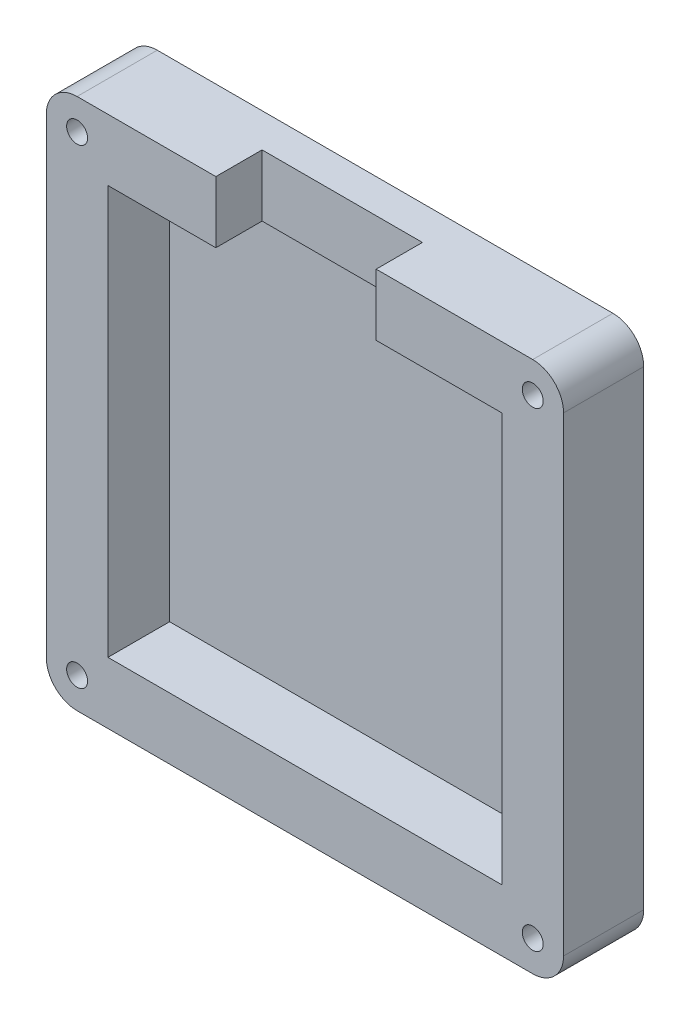
from build123d import *

# Parameters (mm, degrees)
BOSS_EXTRUDE4_START   = 3.1
SKETCH2_R             = 3.25
SKETCH2_R_2           = 1.7
BOSS_EXTRUDE4_DEPTH   = 9.9
BOSS_EXTRUDE4_2_DEPTH = 9.9
BOSS_EXTRUDE4_3_DEPTH = 9.9
BOSS_EXTRUDE4_4_DEPTH = 9.9
SKETCH2_12_W          = 83.893
SKETCH2_12_H          = 86.275
SKETCH2_12_R          = 3.25
SKETCH2_12_W_2        = 63.893
SKETCH2_12_H_2        = 66.275
BOSS_EXTRUDE5_DEPTH   = 13
SKETCH2_13_W          = 63.893
SKETCH2_13_H          = 66.275
BOSS_EXTRUDE6_DEPTH   = 3
SKETCH5_W             = 26
SKETCH5_H             = 10
CUT_EXTRUDE1_DEPTH    = 7.5
FILLET1_R             = 5
SKETCH7_W             = 0.189957265
SKETCH7_H             = 1.546794872
CUT_EXTRUDE2_DEPTH    = 0.2


with BuildPart() as part:
    # Sketch2 → Boss-Extrude4 (new body)
    with BuildSketch(Plane.XY.offset(BOSS_EXTRUDE4_START)):
        with Locations(Location((-36.9465, 38.1375, 0), (0, 0, 180))):
            Circle(SKETCH2_R)
        with Locations(Location((-36.9465, 38.1375, 0), (0, 0, 180))):
            Circle(SKETCH2_R_2, mode=Mode.SUBTRACT)
    extrude(amount=BOSS_EXTRUDE4_DEPTH)



with BuildPart() as body_2:
    # Sketch2 → Boss-Extrude4 2 (new body)
    with BuildSketch(Plane.XY.offset(BOSS_EXTRUDE4_START)):
        with Locations(Location((36.9465, 38.1375, 0), (0, 0, 180))):
            Circle(SKETCH2_R)
        with Locations(Location((36.9465, 38.1375, 0), (0, 0, 180))):
            Circle(SKETCH2_R_2, mode=Mode.SUBTRACT)
    extrude(amount=BOSS_EXTRUDE4_2_DEPTH)


with BuildPart() as body_3:
    # Sketch2 → Boss-Extrude4 3 (new body)
    with BuildSketch(Plane.XY.offset(BOSS_EXTRUDE4_START)):
        with Locations(Location((-36.9465, -38.1375, 0), (0, 0, 180))):
            Circle(SKETCH2_R)
        with Locations(Location((-36.9465, -38.1375, 0), (0, 0, 180))):
            Circle(SKETCH2_R_2, mode=Mode.SUBTRACT)
    extrude(amount=BOSS_EXTRUDE4_3_DEPTH)


with BuildPart() as body_4:
    # Sketch2 → Boss-Extrude4 4 (new body)
    with BuildSketch(Plane.XY.offset(BOSS_EXTRUDE4_START)):
        with Locations(Location((36.9465, -38.1375, 0), (0, 0, 180))):
            Circle(SKETCH2_R)
        with Locations(Location((36.9465, -38.1375, 0), (0, 0, 180))):
            Circle(SKETCH2_R_2, mode=Mode.SUBTRACT)
    extrude(amount=BOSS_EXTRUDE4_4_DEPTH)


with BuildPart() as part_1:
    add(part.part)

    add(body_2.part)  # Boss-Extrude5 merges body 2

    add(body_3.part)  # Boss-Extrude5 merges body 3

    add(body_4.part)  # Boss-Extrude5 merges body 4
    # Sketch2<12> → Boss-Extrude5 (add)
    with BuildSketch(Plane.XY):
        Rectangle(SKETCH2_12_W, SKETCH2_12_H)
        with Locations(Location((36.9465, -38.1375, 0), (0, 0, 180))):
            Circle(SKETCH2_12_R, mode=Mode.SUBTRACT)
        with Locations(Location((-36.9465, -38.1375, 0), (0, 0, 180))):
            Circle(SKETCH2_12_R, mode=Mode.SUBTRACT)
        with Locations(Location((36.9465, 38.1375, 0), (0, 0, 180))):
            Circle(SKETCH2_12_R, mode=Mode.SUBTRACT)
        with Locations(Location((-36.9465, 38.1375, 0), (0, 0, 180))):
            Circle(SKETCH2_12_R, mode=Mode.SUBTRACT)
        Rectangle(SKETCH2_12_W_2, SKETCH2_12_H_2, mode=Mode.SUBTRACT)
    extrude(amount=BOSS_EXTRUDE5_DEPTH)

    # Sketch2<13> → Boss-Extrude6 (add)
    with BuildSketch(Plane.XY):
        Rectangle(SKETCH2_13_W, SKETCH2_13_H)
    extrude(amount=BOSS_EXTRUDE6_DEPTH)

    # Sketch5 → Cut-Extrude1 (cut)
    with BuildSketch(Plane.XY.offset(13)):
        with Locations((-1.4465, 38.1375)):
            Rectangle(SKETCH5_W, SKETCH5_H)
    extrude(amount=-CUT_EXTRUDE1_DEPTH, mode=Mode.SUBTRACT)

    # Fillet1
    fillet1_edges = [part_1.edges().sort_by_distance(p)[0] for p in [
        (41.9465, -43.1375, 6.5),
        (41.9465, 43.1375, 6.5),
        (-41.9465, 43.1375, 6.5),
        (-41.9465, -43.1375, 6.5),
    ]]
    fillet(fillet1_edges, radius=FILLET1_R)

    # Sketch7 → Cut-Extrude2 (cut)
    # profile 1 of 15: a face of its own
    with BuildSketch(Plane(origin=(0, 0, 0), x_dir=(-1, 0, 0), z_dir=(0, 0, -1))):
        with BuildLine():
            Line((0.197612891, 2.170940171), (0.197612891, 0))
            Line((0.197612891, 0), (0.007655626, 0))
            Line((0.007655626, 0), (0.007655626, 0.267551416))
            add(Edge.make_bspline(
                [(0.007655626, 0.267551416), (-0.013764309, 0.243336994), (-0.055565582, 0.196082247), (-0.125379973, 0.134346838), (-0.199383585, 0.083318044), (-0.277217241, 0.042103571), (-0.358810655, 0.011144565), (-0.443982955, -0.010860398), (-0.532768886, -0.025008098), (-0.593397691, -0.026420835), (-0.624121885, -0.027136752)],
                knots=[0, 0, 0, 0, 1.074387032, 2.096679803, 3.090159297, 4.057316773, 5.018401886, 5.985159533, 6.978961417, 8, 8, 8, 8], degree=3))
            add(Edge.make_bspline(
                [(-0.624121885, -0.027136752), (-0.651437743, -0.026395089), (-0.705305824, -0.024932496), (-0.784547218, -0.01358577), (-0.860803007, 0.004636082), (-0.934145248, 0.029976144), (-1.004099355, 0.063589308), (-1.071264271, 0.10383092), (-1.135292042, 0.151752755), (-1.195206734, 0.206536944), (-1.250380373, 0.266042483), (-1.298798381, 0.329509552), (-1.3391681, 0.396663707), (-1.372925959, 0.46665471), (-1.39892851, 0.540021352), (-1.417055422, 0.616509925), (-1.42838893, 0.696029991), (-1.429850918, 0.750180084), (-1.430592237, 0.777637553)],
                knots=[0, 0, 0, 0, 1.033919861, 2.038935746, 3.024066025, 3.998881131, 4.97069526, 5.957263378, 6.95902576, 7.993208707, 9.027059324, 10.027763471, 11.009749337, 11.988697705, 12.965288445, 13.950418724, 14.960734635, 16, 16, 16, 16], degree=3))
            add(Edge.make_bspline(
                [(-1.430592237, 0.777637553), (-1.429834488, 0.804527507), (-1.428336458, 0.857687496), (-1.417176654, 0.935870328), (-1.398410282, 1.011174228), (-1.372074203, 1.083356761), (-1.338303116, 1.152505267), (-1.297222796, 1.218668654), (-1.248830278, 1.282029194), (-1.193039537, 1.341097031), (-1.132602795, 1.395659022), (-1.067948467, 1.443077825), (-1.000684864, 1.484030396), (-0.929768662, 1.516477974), (-0.856249508, 1.542730147), (-0.7794729, 1.560892942), (-0.699758279, 1.571595608), (-0.645637839, 1.57314547), (-0.61818572, 1.573931624)],
                knots=[0, 0, 0, 0, 1.020392517, 2.01726096, 2.990465484, 3.961182959, 4.928053699, 5.906110375, 6.912531644, 7.948652711, 8.985773172, 9.998621852, 10.987621588, 11.969261332, 12.953316658, 13.946091881, 14.958173133, 16, 16, 16, 16], degree=3))
            add(Edge.make_bspline(
                [(-0.61818572, 1.573931624), (-0.586606984, 1.572983904), (-0.524621435, 1.571123635), (-0.433968519, 1.555577403), (-0.348220774, 1.529474139), (-0.266884538, 1.493737983), (-0.190444714, 1.447291815), (-0.118340984, 1.391199273), (-0.05182726, 1.323872856), (-0.0124743, 1.273307761), (0.007655626, 1.247442575)],
                knots=[0, 0, 0, 0, 1.031072012, 2.023879775, 2.993683497, 3.952812103, 4.918022106, 5.908088563, 6.929940113, 8, 8, 8, 8], degree=3))
            Line((0.007655626, 1.247442575), (0.007655626, 2.170940171))
            Line((0.007655626, 2.170940171), (0.197612891, 2.170940171))
        make_face()
        with BuildLine():
            add(Edge.make_bspline(
                [(-0.61564165, 1.383974359), (-0.643408892, 1.382986397), (-0.698217012, 1.381036318), (-0.778676956, 1.365812347), (-0.855671259, 1.34048214), (-0.928814837, 1.305840228), (-0.996952283, 1.262279992), (-1.057847979, 1.209592298), (-1.111999993, 1.149214675), (-1.157543563, 1.08141959), (-1.194670197, 1.008740458), (-1.220775973, 0.932767584), (-1.237993089, 0.85487124), (-1.239752052, 0.802037616), (-1.240634972, 0.775517495)],
                knots=[0, 0, 0, 0, 1.031046209, 2.035121221, 3.029706178, 4.034933723, 5.034054252, 6.02443088, 7.017295772, 8.038157696, 9.050218397, 10.03989886, 11.016116709, 12, 12, 12, 12], degree=3))
            add(Edge.make_bspline(
                [(-1.240634972, 0.775517495), (-1.239507156, 0.749155858), (-1.237255944, 0.696535915), (-1.221078143, 0.618533375), (-1.193936505, 0.542542598), (-1.156899639, 0.469208568), (-1.110522489, 0.401121993), (-1.056766018, 0.339593443), (-0.995110372, 0.286683073), (-0.926816118, 0.242391778), (-0.853877012, 0.206612539), (-0.777172682, 0.181717129), (-0.698145034, 0.1656439), (-0.644410528, 0.16376643), (-0.617337697, 0.162820513)],
                knots=[0, 0, 0, 0, 0.979072187, 1.954306742, 2.945804271, 3.96968567, 4.997920485, 5.998718438, 6.996577872, 8.005894225, 9.015743152, 10.005417472, 10.995077863, 12, 12, 12, 12], degree=3))
            add(Edge.make_bspline(
                [(-0.617337697, 0.162820513), (-0.589853383, 0.163824396), (-0.535189809, 0.165821019), (-0.454491162, 0.181110166), (-0.376177542, 0.206370344), (-0.301315742, 0.24138553), (-0.231576939, 0.284781645), (-0.168985365, 0.335585933), (-0.116059041, 0.394673097), (-0.071190178, 0.459610285), (-0.036007902, 0.530798017), (-0.010380475, 0.60659536), (0.004771172, 0.687004956), (0.006680847, 0.741955997), (0.007655626, 0.770005342)],
                knots=[0, 0, 0, 0, 1.01762866, 2.023962475, 3.030623092, 4.058876274, 5.077231937, 6.066672613, 7.034107872, 8.005628644, 8.981990164, 9.965428785, 10.961468474, 12, 12, 12, 12], degree=3))
            add(Edge.make_bspline(
                [(0.007655626, 0.770005342), (0.007075262, 0.791376316), (0.005932923, 0.833441155), (-0.002794136, 0.895203987), (-0.016676401, 0.954309621), (-0.036238132, 1.0108202), (-0.061935242, 1.064423281), (-0.092927939, 1.115503745), (-0.129761234, 1.163795925), (-0.171842198, 1.20863483), (-0.217904011, 1.249532738), (-0.266644519, 1.286038731), (-0.31864119, 1.316028132), (-0.373019588, 1.34084833), (-0.429874062, 1.360599339), (-0.489667247, 1.373775706), (-0.551763586, 1.382823139), (-0.594124772, 1.383586579), (-0.61564165, 1.383974359)],
                knots=[0, 0, 0, 0, 1.050140795, 2.067009409, 3.05949893, 4.030605086, 5.00011959, 5.97591094, 6.962425594, 7.979863591, 8.993523472, 9.986985069, 10.967611495, 11.937549037, 12.921786183, 13.919465291, 14.943216303, 16, 16, 16, 16], degree=3))
        make_face(mode=Mode.SUBTRACT)
    # profile 2 of 15: a face of its own
    with BuildSketch(Plane(origin=(0, 0, 0), x_dir=(-1, 0, 0), z_dir=(0, 0, -1))):
        with BuildLine():
            Line((2.205732549, 1.546794872), (2.205732549, 0))
            Line((2.205732549, 0), (2.015775284, 0))
            Line((2.015775284, 0), (2.015775284, 0.267551416))
            add(Edge.make_bspline(
                [(2.015775284, 0.267551416), (1.994355349, 0.243336994), (1.952554076, 0.196082247), (1.882739685, 0.134346838), (1.808736073, 0.083318044), (1.730902417, 0.042103571), (1.649309003, 0.011144565), (1.564136703, -0.010860398), (1.475350772, -0.025008098), (1.414721967, -0.026420835), (1.383997773, -0.027136752)],
                knots=[0, 0, 0, 0, 1.074387032, 2.096679803, 3.090159297, 4.057316773, 5.018401886, 5.985159533, 6.978961417, 8, 8, 8, 8], degree=3))
            add(Edge.make_bspline(
                [(1.383997773, -0.027136752), (1.356681916, -0.026395089), (1.302813835, -0.024932496), (1.22357244, -0.01358577), (1.147316651, 0.004636082), (1.07397441, 0.029976144), (1.004020303, 0.063589308), (0.936855387, 0.10383092), (0.872827616, 0.151752755), (0.812912924, 0.206536944), (0.757739285, 0.266042483), (0.709321278, 0.329509552), (0.668951558, 0.396663707), (0.6351937, 0.46665471), (0.609191148, 0.540021352), (0.591064236, 0.616509925), (0.579730728, 0.696029991), (0.57826874, 0.750180084), (0.577527421, 0.777637553)],
                knots=[0, 0, 0, 0, 1.033919861, 2.038935746, 3.024066025, 3.998881131, 4.97069526, 5.957263378, 6.95902576, 7.993208707, 9.027059324, 10.027763471, 11.009749337, 11.988697705, 12.965288445, 13.950418724, 14.960734635, 16, 16, 16, 16], degree=3))
            add(Edge.make_bspline(
                [(0.577527421, 0.777637553), (0.57828517, 0.804527507), (0.5797832, 0.857687496), (0.590943004, 0.935870328), (0.609709376, 1.011174228), (0.636045455, 1.083356761), (0.669816542, 1.152505267), (0.710896862, 1.218668654), (0.75928938, 1.282029194), (0.815080121, 1.341097031), (0.875516863, 1.395659022), (0.940171191, 1.443077825), (1.007434795, 1.484030396), (1.078350996, 1.516477974), (1.15187015, 1.542730147), (1.228646758, 1.560892942), (1.308361379, 1.571595608), (1.362481819, 1.57314547), (1.389933938, 1.573931624)],
                knots=[0, 0, 0, 0, 1.020392517, 2.01726096, 2.990465484, 3.961182959, 4.928053699, 5.906110375, 6.912531644, 7.948652711, 8.985773172, 9.998621852, 10.987621588, 11.969261332, 12.953316658, 13.946091881, 14.958173133, 16, 16, 16, 16], degree=3))
            add(Edge.make_bspline(
                [(1.389933938, 1.573931624), (1.421502424, 1.573062127), (1.483406736, 1.571357083), (1.573956532, 1.55716772), (1.659617716, 1.533195885), (1.741051538, 1.500588636), (1.817965572, 1.457258214), (1.889631663, 1.402599857), (1.956799836, 1.336958282), (1.995734584, 1.286539013), (2.015775284, 1.260586939)],
                knots=[0, 0, 0, 0, 1.038897134, 2.037228247, 3.008116434, 3.962042015, 4.918381754, 5.904844433, 6.921570401, 8, 8, 8, 8], degree=3))
            Line((2.015775284, 1.260586939), (2.015775284, 1.546794872))
            Line((2.015775284, 1.546794872), (2.205732549, 1.546794872))
        make_face()
        with BuildLine():
            add(Edge.make_bspline(
                [(1.392478008, 1.383974359), (1.364710766, 1.382986397), (1.309902646, 1.381036318), (1.229442702, 1.365812347), (1.152448399, 1.34048214), (1.079304821, 1.305840228), (1.011167376, 1.262279992), (0.950271679, 1.209592298), (0.896119665, 1.149214675), (0.850576095, 1.08141959), (0.813449462, 1.008740458), (0.787343685, 0.932767584), (0.770126569, 0.85487124), (0.768367606, 0.802037616), (0.767484686, 0.775517495)],
                knots=[0, 0, 0, 0, 1.031046209, 2.035121221, 3.029706178, 4.034933723, 5.034054252, 6.02443088, 7.017295772, 8.038157696, 9.050218397, 10.03989886, 11.016116709, 12, 12, 12, 12], degree=3))
            add(Edge.make_bspline(
                [(0.767484686, 0.775517495), (0.768612502, 0.749155858), (0.770863714, 0.696535915), (0.787041515, 0.618533375), (0.814183153, 0.542542598), (0.85122002, 0.469208568), (0.897597169, 0.401121993), (0.95135364, 0.339593443), (1.013009286, 0.286683073), (1.08130354, 0.242391778), (1.154242646, 0.206612539), (1.230946976, 0.181717129), (1.309974624, 0.1656439), (1.363709131, 0.16376643), (1.390781961, 0.162820513)],
                knots=[0, 0, 0, 0, 0.979072187, 1.954306742, 2.945804271, 3.96968567, 4.997920485, 5.998718438, 6.996577872, 8.005894225, 9.015743152, 10.005417472, 10.995077863, 12, 12, 12, 12], degree=3))
            add(Edge.make_bspline(
                [(1.390781961, 0.162820513), (1.418266275, 0.163824396), (1.472929849, 0.165821019), (1.553628496, 0.181110166), (1.631942116, 0.206370344), (1.706803916, 0.24138553), (1.776542719, 0.284781645), (1.839134293, 0.335585933), (1.892060617, 0.394673097), (1.936929481, 0.459610285), (1.972111756, 0.530798017), (1.997739183, 0.60659536), (2.01289083, 0.687004956), (2.014800505, 0.741955997), (2.015775284, 0.770005342)],
                knots=[0, 0, 0, 0, 1.01762866, 2.023962475, 3.030623092, 4.058876274, 5.077231937, 6.066672613, 7.034107872, 8.005628644, 8.981990164, 9.965428785, 10.961468474, 12, 12, 12, 12], degree=3))
            add(Edge.make_bspline(
                [(2.015775284, 0.770005342), (2.01519492, 0.791376316), (2.014052581, 0.833441155), (2.005325522, 0.895203987), (1.991443257, 0.954309621), (1.971881526, 1.0108202), (1.946184416, 1.064423281), (1.915191719, 1.115503745), (1.878358424, 1.163795925), (1.83627746, 1.20863483), (1.790215647, 1.249532738), (1.741475139, 1.286038731), (1.689478468, 1.316028132), (1.63510007, 1.34084833), (1.578245596, 1.360599339), (1.518452412, 1.373775706), (1.456356072, 1.382823139), (1.413994886, 1.383586579), (1.392478008, 1.383974359)],
                knots=[0, 0, 0, 0, 1.050140795, 2.067009409, 3.05949893, 4.030605086, 5.00011959, 5.97591094, 6.962425594, 7.979863591, 8.993523472, 9.986985069, 10.967611495, 11.937549037, 12.921786183, 13.919465291, 14.943216303, 16, 16, 16, 16], degree=3))
        make_face(mode=Mode.SUBTRACT)
    # profile 3 of 15: a face of its own
    with BuildSketch(Plane(origin=(0, 0, 0), x_dir=(-1, 0, 0), z_dir=(0, 0, -1))):
        with BuildLine():
            Line((2.585647079, 1.546794872), (2.775604344, 1.546794872))
            Line((2.775604344, 1.546794872), (2.775604344, 1.319100561))
            add(Edge.make_bspline(
                [(2.775604344, 1.319100561), (2.789628022, 1.34030099), (2.816448197, 1.380846647), (2.861026968, 1.434470462), (2.906688507, 1.478869086), (2.953651406, 1.514249785), (3.002261019, 1.540746291), (3.051450508, 1.560154936), (3.101993769, 1.571631693), (3.135958361, 1.573163953), (3.152974803, 1.573931624)],
                knots=[0, 0, 0, 0, 1.2804753, 2.448899062, 3.506932113, 4.484331642, 5.4025378, 6.288909075, 7.142734305, 8, 8, 8, 8], degree=3))
            add(Edge.make_bspline(
                [(3.152974803, 1.573931624), (3.166174534, 1.573211639), (3.193333838, 1.571730223), (3.234447118, 1.561321772), (3.27680673, 1.54470411), (3.304107126, 1.529076928), (3.318339387, 1.520930155)],
                knots=[0, 0, 0, 0, 0.901110191, 1.854092781, 2.881294221, 4, 4, 4, 4], degree=3))
            Line((3.318339387, 1.520930155), (3.214032496, 1.356413595))
            add(Edge.make_bspline(
                [(3.214032496, 1.356413595), (3.204895135, 1.360489851), (3.187550676, 1.368227366), (3.162178153, 1.377384677), (3.138785154, 1.382776683), (3.123881668, 1.383593545), (3.116933804, 1.383974359)],
                knots=[0, 0, 0, 0, 1.180555205, 2.24091978, 3.179933427, 4, 4, 4, 4], degree=3))
            add(Edge.make_bspline(
                [(3.116933804, 1.383974359), (3.101690337, 1.382958336), (3.070598082, 1.380885945), (3.024947932, 1.36459438), (2.980650813, 1.338271973), (2.945470808, 1.309079443), (2.918230969, 1.280929109), (2.898793785, 1.256346503), (2.880963743, 1.228782283), (2.863927467, 1.198707665), (2.84840547, 1.165609139), (2.833918598, 1.129817386), (2.820820143, 1.091290951), (2.813351186, 1.064450094), (2.809525284, 1.050701122)],
                knots=[0, 0, 0, 0, 1.125678352, 2.296057538, 3.5422874, 4.923748041, 5.663163013, 6.437101912, 7.23742474, 8.08941207, 8.991984279, 9.93940061, 10.944477711, 12, 12, 12, 12], degree=3))
            add(Edge.make_bspline(
                [(2.809525284, 1.050701122), (2.806663313, 1.03843826), (2.800324264, 1.011276952), (2.79416081, 0.965709035), (2.788071149, 0.911870917), (2.783779385, 0.84961274), (2.779801236, 0.779089976), (2.777557519, 0.70019519), (2.775680858, 0.612847401), (2.775630622, 0.551781959), (2.775604344, 0.519838408)],
                knots=[0, 0, 0, 0, 0.566838948, 1.255505196, 2.06880316, 3.007127437, 4.065329342, 5.249902469, 6.561414163, 8, 8, 8, 8], degree=3))
            Line((2.775604344, 0.519838408), (2.775604344, 0))
            Line((2.775604344, 0), (2.585647079, 0))
            Line((2.585647079, 0), (2.585647079, 1.546794872))
        make_face()
    # profile 4 of 15: a face of its own
    with BuildSketch(Plane(origin=(0, 0, 0), x_dir=(-1, 0, 0), z_dir=(0, 0, -1))):
        with BuildLine():
            Line((4.240988959, 1.353869525), (4.112089387, 1.221153846))
            add(Edge.make_bspline(
                [(4.112089387, 1.221153846), (4.100967511, 1.234043225), (4.079525843, 1.25889243), (4.045519186, 1.292116275), (4.011638244, 1.320018138), (3.978346819, 1.343574981), (3.944807771, 1.361384703), (3.911414682, 1.374383976), (3.878132978, 1.382428402), (3.855886186, 1.383465229), (3.844961983, 1.383974359)],
                knots=[0, 0, 0, 0, 1.26578478, 2.440284043, 3.530471711, 4.527705817, 5.468200915, 6.346673037, 7.188140097, 8, 8, 8, 8], degree=3))
            add(Edge.make_bspline(
                [(3.844961983, 1.383974359), (3.831572923, 1.383324317), (3.805225149, 1.382045126), (3.767472392, 1.369276527), (3.732426062, 1.349676957), (3.702093031, 1.321876909), (3.676398101, 1.289967089), (3.657642208, 1.254288359), (3.646172303, 1.215917399), (3.644718013, 1.189289819), (3.643980412, 1.175784589)],
                knots=[0, 0, 0, 0, 0.99966794, 1.967205029, 2.953328237, 3.988086729, 5.028030931, 6.008226631, 6.989793394, 8, 8, 8, 8], degree=3))
            add(Edge.make_bspline(
                [(3.643980412, 1.175784589), (3.644652189, 1.163561114), (3.645993849, 1.139148624), (3.656423984, 1.103136241), (3.673034418, 1.068025556), (3.688558774, 1.046518465), (3.69655787, 1.035436699)],
                knots=[0, 0, 0, 0, 0.960159726, 1.917612774, 2.927026955, 4, 4, 4, 4], degree=3))
            add(Edge.make_bspline(
                [(3.69655787, 1.035436699), (3.701373887, 1.029519355), (3.711624174, 1.016925034), (3.730860752, 0.999445085), (3.752645789, 0.980127628), (3.778844037, 0.960813446), (3.808326802, 0.94047426), (3.841733417, 0.919911065), (3.878003712, 0.897556389), (3.90397056, 0.883378087), (3.917467992, 0.87600828)],
                knots=[0, 0, 0, 0, 0.66740084, 1.420478572, 2.27185888, 3.217733974, 4.268547843, 5.408967954, 6.65319498, 8, 8, 8, 8], degree=3))
            add(Edge.make_bspline(
                [(3.917467992, 0.87600828), (3.933925727, 0.866788743), (3.965716651, 0.848979635), (4.010887992, 0.821336147), (4.051883012, 0.793860953), (4.089049058, 0.766847887), (4.121671009, 0.739541153), (4.15073862, 0.712987414), (4.175526869, 0.686384356), (4.18940853, 0.66779814), (4.196043714, 0.658914263)],
                knots=[0, 0, 0, 0, 1.27191281, 2.456916733, 3.569705269, 4.599008579, 5.553216877, 6.436649441, 7.252746552, 8, 8, 8, 8], degree=3))
            add(Edge.make_bspline(
                [(4.196043714, 0.658914263), (4.207056747, 0.640973343), (4.228974727, 0.605267583), (4.251990917, 0.546473581), (4.26533213, 0.484116277), (4.267184045, 0.441461078), (4.268125711, 0.419771635)],
                knots=[0, 0, 0, 0, 0.995354457, 1.980940102, 2.973342416, 4, 4, 4, 4], degree=3))
            add(Edge.make_bspline(
                [(4.268125711, 0.419771635), (4.267690565, 0.404489818), (4.266833061, 0.374375328), (4.260871277, 0.330025216), (4.250617554, 0.287610508), (4.236651331, 0.246670979), (4.21779221, 0.207991048), (4.195689495, 0.170594841), (4.16915562, 0.135291302), (4.138862264, 0.102126788), (4.105693799, 0.071836836), (4.070311515, 0.045212825), (4.032671841, 0.02309406), (3.993043728, 0.004790732), (3.951337137, -0.009764834), (3.907545548, -0.019841698), (3.861808158, -0.025872844), (3.830705369, -0.026710122), (3.814857148, -0.027136752)],
                knots=[0, 0, 0, 0, 1.032770009, 2.035186124, 3.017557409, 3.978232242, 4.952395191, 5.920591857, 6.910227898, 7.931268572, 8.952309245, 9.941945286, 10.918353717, 11.897095711, 12.887975737, 13.898235213, 14.929059601, 16, 16, 16, 16], degree=3))
            add(Edge.make_bspline(
                [(3.814857148, -0.027136752), (3.793468428, -0.026536405), (3.750988182, -0.025344052), (3.688159637, -0.014152291), (3.62676375, 0.003262066), (3.567265133, 0.02728075), (3.510994388, 0.057609991), (3.459510447, 0.093933438), (3.412634468, 0.135051199), (3.385953417, 0.166567102), (3.372612891, 0.182325053)],
                knots=[0, 0, 0, 0, 1.013940152, 2.01379169, 3.017749504, 4.037548394, 5.051665909, 6.043208538, 7.021604269, 8, 8, 8, 8], degree=3))
            Line((3.372612891, 0.182325053), (3.498544381, 0.325641026))
            add(Edge.make_bspline(
                [(3.498544381, 0.325641026), (3.510501983, 0.312726478), (3.533683603, 0.287689673), (3.570756244, 0.254352572), (3.608480929, 0.226411803), (3.646480954, 0.203041738), (3.685318821, 0.185034709), (3.724776882, 0.17238394), (3.764774882, 0.164253405), (3.791639697, 0.16329892), (3.805104878, 0.162820513)],
                knots=[0, 0, 0, 0, 1.179806542, 2.287233372, 3.337373186, 4.324005949, 5.273901747, 6.200048787, 7.097828587, 8, 8, 8, 8], degree=3))
            add(Edge.make_bspline(
                [(3.805104878, 0.162820513), (3.823440005, 0.163649535), (3.859263767, 0.165269307), (3.91057404, 0.179975358), (3.957950257, 0.2030349), (3.999088185, 0.235743265), (4.034105206, 0.273816397), (4.059461768, 0.316702555), (4.075352598, 0.363143102), (4.077218893, 0.395335971), (4.078168446, 0.411715411)],
                knots=[0, 0, 0, 0, 1.072336372, 2.095165389, 3.102688358, 4.141489647, 5.156069229, 6.117746104, 7.042326257, 8, 8, 8, 8], degree=3))
            add(Edge.make_bspline(
                [(4.078168446, 0.411715411), (4.077511497, 0.425207419), (4.076214438, 0.451845582), (4.066028269, 0.490399359), (4.04993383, 0.526968877), (4.034086257, 0.548371187), (4.026015001, 0.559271501)],
                knots=[0, 0, 0, 0, 1.013901739, 2.00181326, 2.98231254, 4, 4, 4, 4], degree=3))
            add(Edge.make_bspline(
                [(4.026015001, 0.559271501), (4.021163362, 0.564735744), (4.010594741, 0.576638838), (3.991208953, 0.593829243), (3.967997065, 0.612357998), (3.940698014, 0.631910912), (3.909256768, 0.652230068), (3.873545894, 0.673208867), (3.834054608, 0.69584373), (3.806132369, 0.710853712), (3.791536502, 0.71869992)],
                knots=[0, 0, 0, 0, 0.615000592, 1.339693406, 2.178160186, 3.116406724, 4.166410947, 5.330106347, 6.604359322, 8, 8, 8, 8], degree=3))
            add(Edge.make_bspline(
                [(3.791536502, 0.71869992), (3.775784486, 0.727492633), (3.745236301, 0.744544509), (3.701967225, 0.771103282), (3.662931444, 0.798116348), (3.627189668, 0.824068398), (3.595644679, 0.850327731), (3.568420748, 0.876923497), (3.544446042, 0.902783108), (3.531173083, 0.921105759), (3.52483311, 0.929857772)],
                knots=[0, 0, 0, 0, 1.262093308, 2.447601706, 3.550203992, 4.582594899, 5.537233252, 6.418365656, 7.244515135, 8, 8, 8, 8], degree=3))
            add(Edge.make_bspline(
                [(3.52483311, 0.929857772), (3.513868414, 0.94748393), (3.49193519, 0.982742405), (3.470638384, 1.041592074), (3.4559995, 1.103546942), (3.454691769, 1.146295659), (3.454023147, 1.168152377)],
                knots=[0, 0, 0, 0, 0.985009483, 1.970363186, 2.962279964, 4, 4, 4, 4], degree=3))
            add(Edge.make_bspline(
                [(3.454023147, 1.168152377), (3.454346208, 1.182440118), (3.454978484, 1.210403251), (3.460024649, 1.251490061), (3.469212017, 1.290526325), (3.480735708, 1.328098285), (3.496751621, 1.363478123), (3.515889858, 1.397137641), (3.538379396, 1.429030316), (3.564289387, 1.458665543), (3.592777691, 1.485583088), (3.623556909, 1.50904702), (3.655934807, 1.529068482), (3.69004847, 1.545859794), (3.726225613, 1.55856063), (3.764213361, 1.567303906), (3.803934822, 1.573143005), (3.831089312, 1.573664965), (3.844961983, 1.573931624)],
                knots=[0, 0, 0, 0, 1.087655834, 2.128696564, 3.144119009, 4.137814668, 5.115653402, 6.093965665, 7.082169637, 8.081268856, 9.086088321, 10.061021666, 11.022561449, 11.980240094, 12.950172527, 13.934149372, 14.944599409, 16, 16, 16, 16], degree=3))
            add(Edge.make_bspline(
                [(3.844961983, 1.573931624), (3.861406707, 1.573263761), (3.894604641, 1.571915506), (3.944409582, 1.561207779), (3.994141174, 1.543589187), (4.0439272, 1.519255846), (4.093402947, 1.487767783), (4.143003617, 1.44971054), (4.193324664, 1.405334494), (4.224745863, 1.371407819), (4.240988959, 1.353869525)],
                knots=[0, 0, 0, 0, 0.845714091, 1.707292901, 2.609013841, 3.555613372, 4.552488639, 5.621697636, 6.770543573, 8, 8, 8, 8], degree=3))
        make_face()
    # profile 5 of 15: a face of its own
    with BuildSketch(Plane(origin=(0, 0, 0), x_dir=(-1, 0, 0), z_dir=(0, 0, -1))):
        with BuildLine():
            Line((4.648040241, 2.170940171), (4.837997506, 2.170940171))
            Line((4.837997506, 2.170940171), (4.837997506, 1.254650775))
            add(Edge.make_bspline(
                [(4.837997506, 1.254650775), (4.858388446, 1.280137849), (4.89809065, 1.32976249), (4.964914492, 1.39450902), (5.033537353, 1.450630091), (5.106329404, 1.495304129), (5.181955195, 1.530595944), (5.260733685, 1.555625615), (5.342679511, 1.571017469), (5.398332816, 1.57295175), (5.426525818, 1.573931624)],
                knots=[0, 0, 0, 0, 1.125788106, 2.19196713, 3.20547328, 4.180437432, 5.132270164, 6.079753143, 7.027236121, 8, 8, 8, 8], degree=3))
            add(Edge.make_bspline(
                [(5.426525818, 1.573931624), (5.455149437, 1.572876054), (5.511172763, 1.57081005), (5.592743933, 1.554473386), (5.668920272, 1.526559126), (5.739475329, 1.488358115), (5.802869312, 1.440779786), (5.859021313, 1.385848342), (5.904886939, 1.322182687), (5.936092119, 1.263365809), (5.956396037, 1.211030467), (5.969248332, 1.166135053), (5.980145657, 1.116107991), (5.989640259, 1.060975034), (5.995968234, 1.000471526), (6.001051027, 0.934870429), (6.004665359, 0.864175505), (6.004805424, 0.815238021), (6.004877848, 0.789933894)],
                knots=[0, 0, 0, 0, 1.235656852, 2.418478516, 3.575258207, 4.727955599, 5.870717718, 6.98870536, 8.107142894, 9.245821548, 9.854588956, 10.528768408, 11.260415777, 12.065282286, 12.943670737, 13.886611085, 14.907229059, 16, 16, 16, 16], degree=3))
            Line((6.004877848, 0.789933894), (6.004877848, 0))
            Line((6.004877848, 0), (5.814920583, 0))
            Line((5.814920583, 0), (5.814920583, 0.727604167))
            add(Edge.make_bspline(
                [(5.814920583, 0.727604167), (5.814805495, 0.748663591), (5.814585351, 0.788946685), (5.813857614, 0.846620474), (5.812233093, 0.898930041), (5.809607927, 0.94570774), (5.806847003, 0.987018786), (5.803047093, 1.022803186), (5.798626141, 1.053110088), (5.794653593, 1.071352506), (5.792871972, 1.079533921)],
                knots=[0, 0, 0, 0, 1.430932559, 2.737130458, 3.918967929, 4.986496826, 5.920444988, 6.731744033, 7.431208747, 8, 8, 8, 8], degree=3))
            add(Edge.make_bspline(
                [(5.792871972, 1.079533921), (5.785963024, 1.103539499), (5.772680611, 1.149690084), (5.741808739, 1.212381161), (5.703249718, 1.265832885), (5.65617066, 1.309323907), (5.601404411, 1.343439457), (5.538593862, 1.367066163), (5.468330163, 1.381730262), (5.418829511, 1.38320546), (5.39302889, 1.383974359)],
                knots=[0, 0, 0, 0, 1.090059168, 2.095632401, 3.037101401, 3.955032261, 4.878929692, 5.839099886, 6.873700383, 8, 8, 8, 8], degree=3))
            add(Edge.make_bspline(
                [(5.39302889, 1.383974359), (5.377747903, 1.383686597), (5.347507225, 1.383117125), (5.302664937, 1.377399767), (5.25916498, 1.36805697), (5.216588424, 1.355414702), (5.175837633, 1.338211925), (5.135724789, 1.318297001), (5.097386387, 1.293920104), (5.060141631, 1.266569283), (5.02547817, 1.236288999), (4.993227962, 1.204329174), (4.964478585, 1.17029622), (4.938432342, 1.134736149), (4.915948331, 1.097161208), (4.896321943, 1.057933739), (4.879669403, 1.017002156), (4.871394632, 0.988593428), (4.867254317, 0.974379006)],
                knots=[0, 0, 0, 0, 1.024319606, 2.027102035, 3.025350316, 4.005802111, 5.00026367, 5.987881639, 7.005602596, 8.042517216, 9.083927026, 10.089214625, 11.084353441, 12.06828073, 13.041928858, 14.016821737, 15.00770877, 16, 16, 16, 16], degree=3))
            add(Edge.make_bspline(
                [(4.867254317, 0.974379006), (4.864871902, 0.964085384), (4.859680325, 0.941654313), (4.854047069, 0.904658412), (4.849004687, 0.861668082), (4.844741993, 0.812748529), (4.842127555, 0.757720492), (4.839310428, 0.696959483), (4.838261762, 0.630084899), (4.838088224, 0.583581426), (4.837997506, 0.559271501)],
                knots=[0, 0, 0, 0, 0.607992626, 1.324890765, 2.152360218, 3.099583803, 4.150613268, 5.323148443, 6.60066238, 8, 8, 8, 8], degree=3))
            Line((4.837997506, 0.559271501), (4.837997506, 0))
            Line((4.837997506, 0), (4.648040241, 0))
            Line((4.648040241, 0), (4.648040241, 2.170940171))
        make_face()
    # profile 6 of 15: a face of its own
    with BuildSketch(Plane(origin=(0, 0, 0), x_dir=(-1, 0, 0), z_dir=(0, 0, -1))):
        Polygon((6.54506882, 1.51965812), (6.413201165, 1.51965812), (6.384792378, 2.170940171), (6.574749643, 2.170940171), align=None)
    # profile 7 of 15: a face of its own
    with BuildSketch(Plane(origin=(0, 0, 0), x_dir=(-1, 0, 0), z_dir=(0, 0, -1))):
        with BuildLine():
            Line((7.741629985, 1.353869525), (7.612730412, 1.221153846))
            add(Edge.make_bspline(
                [(7.612730412, 1.221153846), (7.601608536, 1.234043225), (7.580166869, 1.25889243), (7.546160211, 1.292116275), (7.51227927, 1.320018138), (7.478987845, 1.343574981), (7.445448796, 1.361384703), (7.412055708, 1.374383976), (7.378774004, 1.382428402), (7.356527211, 1.383465229), (7.345603008, 1.383974359)],
                knots=[0, 0, 0, 0, 1.26578478, 2.440284043, 3.530471711, 4.527705817, 5.468200915, 6.346673037, 7.188140097, 8, 8, 8, 8], degree=3))
            add(Edge.make_bspline(
                [(7.345603008, 1.383974359), (7.332213949, 1.383324317), (7.305866175, 1.382045126), (7.268113418, 1.369276527), (7.233067087, 1.349676957), (7.202734057, 1.321876909), (7.177039126, 1.289967089), (7.158283233, 1.254288359), (7.146813329, 1.215917399), (7.145359039, 1.189289819), (7.144621438, 1.175784589)],
                knots=[0, 0, 0, 0, 0.99966794, 1.967205029, 2.953328237, 3.988086729, 5.028030931, 6.008226631, 6.989793394, 8, 8, 8, 8], degree=3))
            add(Edge.make_bspline(
                [(7.144621438, 1.175784589), (7.145293215, 1.163561114), (7.146634875, 1.139148624), (7.15706501, 1.103136241), (7.173675444, 1.068025556), (7.189199799, 1.046518465), (7.197198895, 1.035436699)],
                knots=[0, 0, 0, 0, 0.960159726, 1.917612774, 2.927026955, 4, 4, 4, 4], degree=3))
            add(Edge.make_bspline(
                [(7.197198895, 1.035436699), (7.202014913, 1.029519355), (7.212265199, 1.016925034), (7.231501778, 0.999445085), (7.253286815, 0.980127628), (7.279485063, 0.960813446), (7.308967828, 0.94047426), (7.342374442, 0.919911065), (7.378644738, 0.897556389), (7.404611585, 0.883378087), (7.418109018, 0.87600828)],
                knots=[0, 0, 0, 0, 0.66740084, 1.420478572, 2.27185888, 3.217733974, 4.268547843, 5.408967954, 6.65319498, 8, 8, 8, 8], degree=3))
            add(Edge.make_bspline(
                [(7.418109018, 0.87600828), (7.434566753, 0.866788743), (7.466357677, 0.848979635), (7.511529017, 0.821336147), (7.552524037, 0.793860953), (7.589690084, 0.766847887), (7.622312035, 0.739541153), (7.651379645, 0.712987414), (7.676167895, 0.686384356), (7.690049555, 0.66779814), (7.696684739, 0.658914263)],
                knots=[0, 0, 0, 0, 1.27191281, 2.456916733, 3.569705269, 4.599008579, 5.553216877, 6.436649441, 7.252746552, 8, 8, 8, 8], degree=3))
            add(Edge.make_bspline(
                [(7.696684739, 0.658914263), (7.707697772, 0.640973343), (7.729615753, 0.605267583), (7.752631942, 0.546473581), (7.765973156, 0.484116277), (7.76782507, 0.441461078), (7.768766737, 0.419771635)],
                knots=[0, 0, 0, 0, 0.995354457, 1.980940102, 2.973342416, 4, 4, 4, 4], degree=3))
            add(Edge.make_bspline(
                [(7.768766737, 0.419771635), (7.76833159, 0.404489818), (7.767474086, 0.374375328), (7.761512303, 0.330025216), (7.751258579, 0.287610508), (7.737292357, 0.246670979), (7.718433236, 0.207991048), (7.696330521, 0.170594841), (7.669796645, 0.135291302), (7.63950329, 0.102126788), (7.606334824, 0.071836836), (7.570952541, 0.045212825), (7.533312867, 0.02309406), (7.493684754, 0.004790732), (7.451978163, -0.009764834), (7.408186573, -0.019841698), (7.362449184, -0.025872844), (7.331346395, -0.026710122), (7.315498174, -0.027136752)],
                knots=[0, 0, 0, 0, 1.032770009, 2.035186124, 3.017557409, 3.978232242, 4.952395191, 5.920591857, 6.910227898, 7.931268572, 8.952309245, 9.941945286, 10.918353717, 11.897095711, 12.887975737, 13.898235213, 14.929059601, 16, 16, 16, 16], degree=3))
            add(Edge.make_bspline(
                [(7.315498174, -0.027136752), (7.294109454, -0.026536405), (7.251629207, -0.025344052), (7.188800663, -0.014152291), (7.127404776, 0.003262066), (7.067906158, 0.02728075), (7.011635413, 0.057609991), (6.960151473, 0.093933438), (6.913275493, 0.135051199), (6.886594442, 0.166567102), (6.873253917, 0.182325053)],
                knots=[0, 0, 0, 0, 1.013940152, 2.01379169, 3.017749504, 4.037548394, 5.051665909, 6.043208538, 7.021604269, 8, 8, 8, 8], degree=3))
            Line((6.873253917, 0.182325053), (6.999185407, 0.325641026))
            add(Edge.make_bspline(
                [(6.999185407, 0.325641026), (7.011143009, 0.312726478), (7.034324629, 0.287689673), (7.071397269, 0.254352572), (7.109121955, 0.226411803), (7.14712198, 0.203041738), (7.185959846, 0.185034709), (7.225417908, 0.17238394), (7.265415907, 0.164253405), (7.292280723, 0.16329892), (7.305745904, 0.162820513)],
                knots=[0, 0, 0, 0, 1.179806542, 2.287233372, 3.337373186, 4.324005949, 5.273901747, 6.200048787, 7.097828587, 8, 8, 8, 8], degree=3))
            add(Edge.make_bspline(
                [(7.305745904, 0.162820513), (7.32408103, 0.163649535), (7.359904792, 0.165269307), (7.411215065, 0.179975358), (7.458591282, 0.2030349), (7.49972921, 0.235743265), (7.534746231, 0.273816397), (7.560102794, 0.316702555), (7.575993624, 0.363143102), (7.577859918, 0.395335971), (7.578809472, 0.411715411)],
                knots=[0, 0, 0, 0, 1.072336372, 2.095165389, 3.102688358, 4.141489647, 5.156069229, 6.117746104, 7.042326257, 8, 8, 8, 8], degree=3))
            add(Edge.make_bspline(
                [(7.578809472, 0.411715411), (7.578152523, 0.425207419), (7.576855464, 0.451845582), (7.566669295, 0.490399359), (7.550574855, 0.526968877), (7.534727282, 0.548371187), (7.526656027, 0.559271501)],
                knots=[0, 0, 0, 0, 1.013901739, 2.00181326, 2.98231254, 4, 4, 4, 4], degree=3))
            add(Edge.make_bspline(
                [(7.526656027, 0.559271501), (7.521804388, 0.564735744), (7.511235767, 0.576638838), (7.491849978, 0.593829243), (7.46863809, 0.612357998), (7.441339039, 0.631910912), (7.409897793, 0.652230068), (7.37418692, 0.673208867), (7.334695634, 0.69584373), (7.306773395, 0.710853712), (7.292177528, 0.71869992)],
                knots=[0, 0, 0, 0, 0.615000592, 1.339693406, 2.178160186, 3.116406724, 4.166410947, 5.330106347, 6.604359322, 8, 8, 8, 8], degree=3))
            add(Edge.make_bspline(
                [(7.292177528, 0.71869992), (7.276425512, 0.727492633), (7.245877327, 0.744544509), (7.202608251, 0.771103282), (7.16357247, 0.798116348), (7.127830694, 0.824068398), (7.096285705, 0.850327731), (7.069061774, 0.876923497), (7.045087067, 0.902783108), (7.031814109, 0.921105759), (7.025474136, 0.929857772)],
                knots=[0, 0, 0, 0, 1.262093308, 2.447601706, 3.550203992, 4.582594899, 5.537233252, 6.418365656, 7.244515135, 8, 8, 8, 8], degree=3))
            add(Edge.make_bspline(
                [(7.025474136, 0.929857772), (7.01450944, 0.94748393), (6.992576216, 0.982742405), (6.97127941, 1.041592074), (6.956640526, 1.103546942), (6.955332794, 1.146295659), (6.954664173, 1.168152377)],
                knots=[0, 0, 0, 0, 0.985009483, 1.970363186, 2.962279964, 4, 4, 4, 4], degree=3))
            add(Edge.make_bspline(
                [(6.954664173, 1.168152377), (6.954987234, 1.182440118), (6.95561951, 1.210403251), (6.960665675, 1.251490061), (6.969853043, 1.290526325), (6.981376734, 1.328098285), (6.997392646, 1.363478123), (7.016530884, 1.397137641), (7.039020422, 1.429030316), (7.064930412, 1.458665543), (7.093418717, 1.485583088), (7.124197935, 1.50904702), (7.156575833, 1.529068482), (7.190689496, 1.545859794), (7.226866639, 1.55856063), (7.264854387, 1.567303906), (7.304575847, 1.573143005), (7.331730338, 1.573664965), (7.345603008, 1.573931624)],
                knots=[0, 0, 0, 0, 1.087655834, 2.128696564, 3.144119009, 4.137814668, 5.115653402, 6.093965665, 7.082169637, 8.081268856, 9.086088321, 10.061021666, 11.022561449, 11.980240094, 12.950172527, 13.934149372, 14.944599409, 16, 16, 16, 16], degree=3))
            add(Edge.make_bspline(
                [(7.345603008, 1.573931624), (7.362047733, 1.573263761), (7.395245667, 1.571915506), (7.445050607, 1.561207779), (7.4947822, 1.543589187), (7.544568226, 1.519255846), (7.594043972, 1.487767783), (7.643644643, 1.44971054), (7.69396569, 1.405334494), (7.725386888, 1.371407819), (7.741629985, 1.353869525)],
                knots=[0, 0, 0, 0, 0.845714091, 1.707292901, 2.609013841, 3.555613372, 4.552488639, 5.621697636, 6.770543573, 8, 8, 8, 8], degree=3))
        make_face()
    # profile 8 of 15: a face of its own
    with BuildSketch(Plane(origin=(0, 0, 0), x_dir=(-1, 0, 0), z_dir=(0, 0, -1))):
        Polygon((9.152741096, 2.170940171), (9.342698361, 2.170940171), (9.342698361, 1.546794872), (9.614065882, 1.546794872), (9.614065882, 1.356837607), (9.342698361, 1.356837607), (9.342698361, 0), (9.152741096, 0), (9.152741096, 1.356837607), (8.881373575, 1.356837607), (8.881373575, 1.546794872), (9.152741096, 1.546794872), align=None)
    # profile 9 of 15: a face of its own
    with BuildSketch(Plane(origin=(0, 0, 0), x_dir=(-1, 0, 0), z_dir=(0, 0, -1))):
        with BuildLine():
            Line((11.209198094, 0.488461538), (11.377954771, 0.399843082))
            add(Edge.make_bspline(
                [(11.377954771, 0.399843082), (11.364506926, 0.375989258), (11.338342743, 0.329579163), (11.293348005, 0.26581799), (11.246181371, 0.208457705), (11.194713733, 0.159030723), (11.140484927, 0.1159406), (11.083194227, 0.078241058), (11.02254337, 0.046117001), (10.958529489, 0.019052377), (10.890614998, -0.001757175), (10.818635319, -0.016455441), (10.742452558, -0.025540942), (10.690233678, -0.026596337), (10.663494969, -0.027136752)],
                knots=[0, 0, 0, 0, 1.120438281, 2.179929193, 3.190490725, 4.156257408, 5.095198341, 6.022838206, 6.959905092, 7.901321166, 8.864066838, 9.862729781, 10.905609505, 12, 12, 12, 12], degree=3))
            add(Edge.make_bspline(
                [(10.663494969, -0.027136752), (10.633775773, -0.026442984), (10.575802231, -0.025089644), (10.491413908, -0.013422296), (10.411960641, 0.005610987), (10.337446896, 0.032199672), (10.268055153, 0.06692953), (10.203647493, 0.109238359), (10.143885209, 0.158908818), (10.09065152, 0.216371143), (10.042727839, 0.277864517), (10.000439367, 0.3419426), (9.965086539, 0.408444169), (9.936328532, 0.476945867), (9.913102733, 0.547015936), (9.89691525, 0.619291919), (9.887583926, 0.693578201), (9.886154, 0.743832304), (9.885433404, 0.769157318)],
                knots=[0, 0, 0, 0, 1.145258523, 2.234067595, 3.276747158, 4.290159414, 5.277019952, 6.260822364, 7.254936242, 8.264827045, 9.274100331, 10.257902744, 11.220704747, 12.172965371, 13.118907548, 14.062713208, 15.023725156, 16, 16, 16, 16], degree=3))
            add(Edge.make_bspline(
                [(9.885433404, 0.769157318), (9.886073932, 0.792921335), (9.887343375, 0.840018477), (9.895344851, 0.909726688), (9.909525485, 0.977477228), (9.9289845, 1.043326394), (9.954113111, 1.107163932), (9.984854501, 1.169028695), (10.021256558, 1.228854851), (10.04936146, 1.266593889), (10.06351834, 1.285603632)],
                knots=[0, 0, 0, 0, 1.024358464, 2.0301432, 3.019427413, 4.004406732, 4.986367066, 5.972626655, 6.978780325, 8, 8, 8, 8], degree=3))
            add(Edge.make_bspline(
                [(10.06351834, 1.285603632), (10.082693938, 1.308505282), (10.120437701, 1.353583116), (10.184274164, 1.412812485), (10.253398568, 1.462429435), (10.326944647, 1.50355756), (10.405767181, 1.534807813), (10.48880661, 1.558095732), (10.577008464, 1.571145291), (10.637306383, 1.572988504), (10.668159098, 1.573931624)],
                knots=[0, 0, 0, 0, 1.030682036, 2.02871468, 2.997146059, 3.962720338, 4.930598197, 5.918074684, 6.934738563, 8, 8, 8, 8], degree=3))
            add(Edge.make_bspline(
                [(10.668159098, 1.573931624), (10.699877412, 1.573112747), (10.762101513, 1.571506296), (10.852835224, 1.556613228), (10.938687658, 1.532995731), (11.019624458, 1.499640819), (11.095653831, 1.456606233), (11.166281585, 1.403301405), (11.232715595, 1.341362848), (11.271365068, 1.293729859), (11.291032362, 1.269491186)],
                knots=[0, 0, 0, 0, 1.056321875, 2.072262726, 3.055038591, 4.01806755, 4.982017516, 5.957941055, 6.960871419, 8, 8, 8, 8], degree=3))
            add(Edge.make_bspline(
                [(11.291032362, 1.269491186), (11.304413891, 1.25122521), (11.331087879, 1.214814843), (11.36449922, 1.155444668), (11.393502026, 1.093329213), (11.41668434, 1.027464414), (11.435455848, 0.958630668), (11.449036877, 0.886335891), (11.45700136, 0.810601611), (11.458566906, 0.758999361), (11.459365028, 0.732692308)],
                knots=[0, 0, 0, 0, 0.94817472, 1.890038105, 2.849395472, 3.817997239, 4.812318967, 5.836947057, 6.897266129, 8, 8, 8, 8], degree=3))
            Line((11.459365028, 0.732692308), (10.075390669, 0.732692308))
            add(Edge.make_bspline(
                [(10.075390669, 0.732692308), (10.076321764, 0.712311551), (10.078152725, 0.672233614), (10.086689026, 0.613589379), (10.100144237, 0.5577255), (10.119054575, 0.505060994), (10.141955, 0.454908012), (10.170007315, 0.40763859), (10.203474569, 0.363468032), (10.24080392, 0.322001239), (10.282355354, 0.285074017), (10.326069206, 0.252022705), (10.372571505, 0.224321225), (10.421495584, 0.201836244), (10.47276233, 0.184233853), (10.526387896, 0.172218552), (10.582266757, 0.16417092), (10.620358129, 0.163276075), (10.639750311, 0.162820513)],
                knots=[0, 0, 0, 0, 1.094153842, 2.151609401, 3.174256925, 4.172055639, 5.149267565, 6.128595816, 7.11444997, 8.118368179, 9.117203808, 10.09244225, 11.054858984, 12.015122123, 12.976791628, 13.957293641, 14.960065497, 16, 16, 16, 16], degree=3))
            add(Edge.make_bspline(
                [(10.639750311, 0.162820513), (10.658710291, 0.163188242), (10.696330527, 0.163917888), (10.752356189, 0.171012901), (10.807473903, 0.182485401), (10.861455545, 0.198142681), (10.913205533, 0.217239158), (10.961130223, 0.240282315), (11.005205401, 0.265772876), (11.046399947, 0.294928251), (11.086357167, 0.330614154), (11.125994766, 0.375146233), (11.168495409, 0.427813452), (11.195098639, 0.467452974), (11.209198094, 0.488461538)],
                knots=[0, 0, 0, 0, 0.99110716, 1.966546729, 2.947904876, 3.932708344, 4.903319531, 5.828989031, 6.710028674, 7.56322171, 8.463672341, 9.504779593, 10.677557249, 12, 12, 12, 12], degree=3))
        make_face()
        with BuildLine():
            add(Edge.make_bspline(
                [(11.269407763, 0.922649573), (11.262455042, 0.947845692), (11.249073293, 0.99634011), (11.221111301, 1.06349341), (11.189620417, 1.123176093), (11.152353942, 1.174931395), (11.110130236, 1.220895424), (11.061359102, 1.261062854), (11.006666919, 1.296996265), (10.946336391, 1.327326586), (10.882448263, 1.353143787), (10.815557852, 1.370455166), (10.747305761, 1.38231427), (10.701141693, 1.383418631), (10.677911368, 1.383974359)],
                knots=[0, 0, 0, 0, 1.154881502, 2.222775134, 3.210006277, 4.132804581, 5.035138423, 5.962687519, 6.919655026, 7.923214229, 8.944639381, 9.960483929, 10.97369054, 12, 12, 12, 12], degree=3))
            add(Edge.make_bspline(
                [(10.677911368, 1.383974359), (10.658952422, 1.383604443), (10.621474572, 1.382873198), (10.566259164, 1.375936501), (10.513233822, 1.364470309), (10.462007291, 1.348767692), (10.413250861, 1.327837728), (10.365961644, 1.303294538), (10.321342071, 1.273333676), (10.293437573, 1.250498559), (10.279340321, 1.23896234)],
                knots=[0, 0, 0, 0, 1.04873581, 2.073130211, 3.073294108, 4.04793562, 5.032784715, 6.005352987, 6.992311501, 8, 8, 8, 8], degree=3))
            add(Edge.make_bspline(
                [(10.279340321, 1.23896234), (10.26924486, 1.229833873), (10.248814108, 1.21136008), (10.22151484, 1.179531941), (10.195376745, 1.145210758), (10.17158925, 1.107083468), (10.1497709, 1.065584235), (10.129354152, 1.021063094), (10.110977607, 0.973182201), (10.100638531, 0.939816012), (10.095319221, 0.922649573)],
                knots=[0, 0, 0, 0, 0.879870761, 1.780643979, 2.707998968, 3.669668524, 4.684282772, 5.740141944, 6.837334558, 8, 8, 8, 8], degree=3))
            Line((10.095319221, 0.922649573), (11.269407763, 0.922649573))
        make_face(mode=Mode.SUBTRACT)
    # profile 10 of 15: a face of its own
    with BuildSketch(Plane(origin=(0, 0, 0), x_dir=(-1, 0, 0), z_dir=(0, 0, -1))):
        Polygon((12.029236823, 2.170940171), (12.219194087, 2.170940171), (12.219194087, 1.546794872), (12.490561609, 1.546794872), (12.490561609, 1.356837607), (12.219194087, 1.356837607), (12.219194087, 0), (12.029236823, 0), (12.029236823, 1.356837607), (11.757869301, 1.356837607), (11.757869301, 1.546794872), (12.029236823, 1.546794872), align=None)
    # profile 11 of 15: a face of its own
    with BuildSketch(Plane(origin=(0, 0, 0), x_dir=(-1, 0, 0), z_dir=(0, 0, -1))):
        with BuildLine():
            Line((12.76192913, 1.546794872), (12.951886395, 1.546794872))
            Line((12.951886395, 1.546794872), (12.951886395, 1.319100561))
            add(Edge.make_bspline(
                [(12.951886395, 1.319100561), (12.965910073, 1.34030099), (12.992730248, 1.380846647), (13.03730902, 1.434470462), (13.082970558, 1.478869086), (13.129933457, 1.514249785), (13.17854307, 1.540746291), (13.22773256, 1.560154936), (13.27827582, 1.571631693), (13.312240412, 1.573163953), (13.329256855, 1.573931624)],
                knots=[0, 0, 0, 0, 1.2804753, 2.448899062, 3.506932113, 4.484331642, 5.4025378, 6.288909075, 7.142734305, 8, 8, 8, 8], degree=3))
            add(Edge.make_bspline(
                [(13.329256855, 1.573931624), (13.342456585, 1.573211639), (13.369615889, 1.571730223), (13.41072917, 1.561321772), (13.453088781, 1.54470411), (13.480389177, 1.529076928), (13.494621438, 1.520930155)],
                knots=[0, 0, 0, 0, 0.901110191, 1.854092781, 2.881294221, 4, 4, 4, 4], degree=3))
            Line((13.494621438, 1.520930155), (13.390314547, 1.356413595))
            add(Edge.make_bspline(
                [(13.390314547, 1.356413595), (13.381177186, 1.360489851), (13.363832727, 1.368227366), (13.338460204, 1.377384677), (13.315067205, 1.382776683), (13.30016372, 1.383593545), (13.293215856, 1.383974359)],
                knots=[0, 0, 0, 0, 1.180555205, 2.24091978, 3.179933427, 4, 4, 4, 4], degree=3))
            add(Edge.make_bspline(
                [(13.293215856, 1.383974359), (13.277972388, 1.382958336), (13.246880133, 1.380885945), (13.201229984, 1.36459438), (13.156932864, 1.338271973), (13.121752859, 1.309079443), (13.09451302, 1.280929109), (13.075075836, 1.256346503), (13.057245794, 1.228782283), (13.040209518, 1.198707665), (13.024687521, 1.165609139), (13.01020065, 1.129817386), (12.997102194, 1.091290951), (12.989633237, 1.064450094), (12.985807335, 1.050701122)],
                knots=[0, 0, 0, 0, 1.125678352, 2.296057538, 3.5422874, 4.923748041, 5.663163013, 6.437101912, 7.23742474, 8.08941207, 8.991984279, 9.93940061, 10.944477711, 12, 12, 12, 12], degree=3))
            add(Edge.make_bspline(
                [(12.985807335, 1.050701122), (12.982945364, 1.03843826), (12.976606315, 1.011276952), (12.970442861, 0.965709035), (12.964353201, 0.911870917), (12.960061436, 0.84961274), (12.956083287, 0.779089976), (12.953839571, 0.70019519), (12.951962909, 0.612847401), (12.951912674, 0.551781959), (12.951886395, 0.519838408)],
                knots=[0, 0, 0, 0, 0.566838948, 1.255505196, 2.06880316, 3.007127437, 4.065329342, 5.249902469, 6.561414163, 8, 8, 8, 8], degree=3))
            Line((12.951886395, 0.519838408), (12.951886395, 0))
            Line((12.951886395, 0), (12.76192913, 0))
            Line((12.76192913, 0), (12.76192913, 1.546794872))
        make_face()
    # profile 12 of 15: a face of its own
    with BuildSketch(Plane(origin=(0, 0, 0), x_dir=(-1, 0, 0), z_dir=(0, 0, -1))):
        with BuildLine():
            add(Edge.make_bspline(
                [(13.75157256, 2.198076923), (13.763360165, 2.197530126), (13.78644256, 2.196459393), (13.819821346, 2.187290309), (13.850214872, 2.171748118), (13.877173787, 2.150896121), (13.900307071, 2.126373362), (13.916503024, 2.097791729), (13.926912425, 2.066913409), (13.928169456, 2.04537476), (13.928809472, 2.034408387)],
                knots=[0, 0, 0, 0, 1.055194115, 2.066272739, 3.074728998, 4.095836921, 5.109056067, 6.073838105, 7.019297344, 8, 8, 8, 8], degree=3))
            add(Edge.make_bspline(
                [(13.928809472, 2.034408387), (13.928155023, 2.023726687), (13.926861255, 2.002610231), (13.916511064, 1.972267226), (13.900169044, 1.944082731), (13.877188621, 1.919607587), (13.850210941, 1.898767117), (13.81982239, 1.88322187), (13.786442285, 1.874053596), (13.763360072, 1.872982751), (13.75157256, 1.872435897)],
                knots=[0, 0, 0, 0, 0.96129708, 1.900370562, 2.859976407, 3.87933698, 4.906634145, 5.921202961, 6.938410037, 8, 8, 8, 8], degree=3))
            add(Edge.make_bspline(
                [(13.75157256, 1.872435897), (13.739919841, 1.872961871), (13.717239346, 1.87398561), (13.684360351, 1.883401764), (13.654225979, 1.898772436), (13.627214486, 1.919471129), (13.604699084, 1.944233043), (13.588311049, 1.972250026), (13.577984763, 2.00261461), (13.576687773, 2.023728158), (13.576031694, 2.034408387)],
                knots=[0, 0, 0, 0, 1.054934014, 2.053291228, 3.073705704, 4.106921865, 5.123545215, 6.088680038, 7.033164197, 8, 8, 8, 8], degree=3))
            add(Edge.make_bspline(
                [(13.576031694, 2.034408387), (13.576673399, 2.045373234), (13.577933748, 2.066908886), (13.588318789, 2.097809215), (13.604562578, 2.126221837), (13.627229395, 2.151032497), (13.654222011, 2.171742831), (13.684361376, 2.187110425), (13.717239075, 2.196527377), (13.739919749, 2.197551006), (13.75157256, 2.198076923)],
                knots=[0, 0, 0, 0, 0.98631895, 1.937192651, 2.907499808, 3.917963147, 4.944918757, 5.95915025, 6.951458133, 8, 8, 8, 8], degree=3))
        make_face()
    # profile 13 of 15: a face of its own
    with BuildSketch(Plane(origin=(0, 0, 0), x_dir=(-1, 0, 0), z_dir=(0, 0, -1))):
        with Locations((13.752420584, 0.773397436)):
            Rectangle(SKETCH7_W, SKETCH7_H)
    # profile 14 of 15: a face of its own
    with BuildSketch(Plane(origin=(0, 0, 0), x_dir=(-1, 0, 0), z_dir=(0, 0, -1))):
        with BuildLine():
            add(Edge.make_bspline(
                [(15.055832709, 1.573931624), (15.084856003, 1.573313623), (15.141763589, 1.572101875), (15.225104548, 1.559150919), (15.304658035, 1.539346561), (15.380728732, 1.511968045), (15.452342397, 1.475269913), (15.520542149, 1.431479532), (15.585141007, 1.379601487), (15.623859696, 1.339470655), (15.643512998, 1.319100561)],
                knots=[0, 0, 0, 0, 1.054011418, 2.066658804, 3.057071809, 4.030435133, 4.997543892, 5.974964718, 6.972108034, 8, 8, 8, 8], degree=3))
            add(Edge.make_bspline(
                [(15.643512998, 1.319100561), (15.660435418, 1.299618769), (15.693952762, 1.261032213), (15.736930601, 1.198466199), (15.773955069, 1.133671948), (15.803626478, 1.065789041), (15.827021707, 0.995410073), (15.843631914, 0.922293143), (15.85351187, 0.846599723), (15.85484414, 0.79519264), (15.855518874, 0.769157318)],
                knots=[0, 0, 0, 0, 1.025258237, 2.030674902, 3.01204498, 3.988269485, 4.97094183, 5.956517959, 6.965070386, 8, 8, 8, 8], degree=3))
            add(Edge.make_bspline(
                [(15.855518874, 0.769157318), (15.854925398, 0.742971093), (15.853752663, 0.69122589), (15.842659143, 0.615014179), (15.825404629, 0.541115405), (15.800711089, 0.469838957), (15.769046899, 0.400966961), (15.730408245, 0.334800234), (15.684523981, 0.271208229), (15.63251204, 0.210730927), (15.575028287, 0.154992312), (15.512667568, 0.106412834), (15.446655367, 0.064792198), (15.376113911, 0.031266366), (15.301687383, 0.004832404), (15.223215251, -0.013733796), (15.140819423, -0.024959195), (15.084560103, -0.02640069), (15.055832709, -0.027136752)],
                knots=[0, 0, 0, 0, 0.998656419, 1.973391657, 2.932242238, 3.890759089, 4.846373663, 5.82037756, 6.809684879, 7.83454468, 8.860553229, 9.859544525, 10.845671541, 11.83227036, 12.833544569, 13.85385346, 14.904124723, 16, 16, 16, 16], degree=3))
            add(Edge.make_bspline(
                [(15.055832709, -0.027136752), (15.026964569, -0.026398219), (14.970424859, -0.024951765), (14.887738194, -0.013777408), (14.809125424, 0.004823848), (14.734601462, 0.031353236), (14.663756721, 0.06479327), (14.59736203, 0.106287006), (14.534950653, 0.155006719), (14.477454739, 0.210727024), (14.425446058, 0.271209235), (14.379560953, 0.334799973), (14.340922518, 0.400967029), (14.309258271, 0.469838939), (14.284564746, 0.54111541), (14.267310228, 0.615014177), (14.256216709, 0.691225891), (14.255043973, 0.742971093), (14.254450498, 0.769157318)],
                knots=[0, 0, 0, 0, 1.099876186, 2.154163076, 3.173186993, 4.173200201, 5.163417411, 6.152872554, 7.150605724, 8.17532212, 9.198891216, 10.186952605, 11.159729845, 12.11414092, 13.071450619, 14.029093627, 15.002601286, 16, 16, 16, 16], degree=3))
            add(Edge.make_bspline(
                [(14.254450498, 0.769157318), (14.255129833, 0.795051134), (14.2564748, 0.846316439), (14.266344822, 0.921867567), (14.282890235, 0.99486075), (14.306313508, 1.064968061), (14.336258409, 1.132553492), (14.372762617, 1.197507842), (14.416178856, 1.25979094), (14.449562894, 1.298327627), (14.466456374, 1.317828526)],
                knots=[0, 0, 0, 0, 1.031353054, 2.041901799, 3.029428768, 4.008703097, 4.981709435, 5.96992636, 6.972712378, 8, 8, 8, 8], degree=3))
            add(Edge.make_bspline(
                [(14.466456374, 1.317828526), (14.486080046, 1.338375275), (14.524673449, 1.378784072), (14.58959387, 1.430510884), (14.657625847, 1.47521251), (14.730030922, 1.511181459), (14.806039126, 1.53950761), (14.886000287, 1.559201993), (14.969624052, 1.572055213), (15.026810108, 1.57329992), (15.055832709, 1.573931624)],
                knots=[0, 0, 0, 0, 1.027980169, 2.021703884, 2.998553061, 3.971491411, 4.943284454, 5.930300938, 6.949603206, 8, 8, 8, 8], degree=3))
        make_face()
        with BuildLine():
            add(Edge.make_bspline(
                [(15.054984686, 1.383974359), (15.034460511, 1.383391011), (14.993941991, 1.382239373), (14.934300623, 1.373480059), (14.876884434, 1.359602283), (14.821584495, 1.339884592), (14.768587291, 1.314424782), (14.717842081, 1.283153535), (14.669199605, 1.246485033), (14.623611405, 1.204476655), (14.581772578, 1.15858793), (14.545197802, 1.109693923), (14.514097857, 1.058587704), (14.488189761, 1.005216128), (14.468893509, 0.949038335), (14.454879348, 0.890690525), (14.446128297, 0.830053821), (14.444987488, 0.788832633), (14.444407763, 0.767885283)],
                knots=[0, 0, 0, 0, 1.021534396, 2.016698045, 2.994645724, 3.958388632, 4.93408049, 5.916473867, 6.921342795, 7.962252576, 8.998418191, 10.008913653, 10.997312074, 11.973003931, 12.956656626, 13.948281152, 14.957379055, 16, 16, 16, 16], degree=3))
            add(Edge.make_bspline(
                [(14.444407763, 0.767885283), (14.445379508, 0.740820962), (14.447308242, 0.687103345), (14.462992885, 0.607993762), (14.489231254, 0.532046641), (14.524662609, 0.459707208), (14.569055894, 0.39277683), (14.621359977, 0.333104076), (14.68101351, 0.281586942), (14.747305393, 0.238841859), (14.818881576, 0.204878578), (14.894631828, 0.180809674), (14.973638342, 0.16516346), (15.027631928, 0.16360833), (15.054984686, 0.162820513)],
                knots=[0, 0, 0, 0, 1.016792936, 2.018143844, 3.017858371, 4.030088057, 5.03801393, 6.028138512, 7.003788237, 7.991172063, 8.984598303, 9.972568034, 10.972917682, 12, 12, 12, 12], degree=3))
            add(Edge.make_bspline(
                [(15.054984686, 0.162820513), (15.082335871, 0.16361292), (15.13632635, 0.165177111), (15.215223091, 0.180730873), (15.290766302, 0.20498404), (15.362268141, 0.238803662), (15.428529849, 0.281749265), (15.488612413, 0.332813169), (15.540469906, 0.392934879), (15.584819277, 0.459795861), (15.620830878, 0.531934493), (15.646946434, 0.608007779), (15.662668783, 0.687099775), (15.664592427, 0.740819766), (15.665561609, 0.767885283)],
                knots=[0, 0, 0, 0, 1.02726834, 2.027799167, 3.010890988, 4.004497153, 4.992059811, 5.971914811, 6.958719428, 7.966827853, 8.981595046, 9.981490638, 10.983022906, 12, 12, 12, 12], degree=3))
            add(Edge.make_bspline(
                [(15.665561609, 0.767885283), (15.664982084, 0.788832758), (15.663841667, 0.830054192), (15.655087759, 0.890689105), (15.641084171, 0.949043546), (15.621748955, 1.005196901), (15.595953432, 1.058725891), (15.564253753, 1.109543869), (15.527828323, 1.158757304), (15.485484636, 1.204328315), (15.439944021, 1.246501409), (15.391281832, 1.283167754), (15.340611868, 1.314287348), (15.28776863, 1.34010236), (15.232461601, 1.359422894), (15.175125861, 1.37356019), (15.115738962, 1.382202357), (15.075365636, 1.383379914), (15.054984686, 1.383974359)],
                knots=[0, 0, 0, 0, 1.042956736, 2.052379634, 3.044323526, 4.02829302, 5.004299113, 5.996692471, 7.007513377, 8.048758398, 9.090003419, 10.095195979, 11.07790575, 12.047570684, 13.018257071, 13.989683339, 14.985167495, 16, 16, 16, 16], degree=3))
        make_face(mode=Mode.SUBTRACT)
    # profile 15 of 15: a face of its own
    with BuildSketch(Plane(origin=(0, 0, 0), x_dir=(-1, 0, 0), z_dir=(0, 0, -1))):
        with BuildLine():
            Line((16.968125711, 1.353869525), (16.839226139, 1.221153846))
            add(Edge.make_bspline(
                [(16.839226139, 1.221153846), (16.828104263, 1.234043225), (16.806662595, 1.25889243), (16.772655938, 1.292116275), (16.738774997, 1.320018138), (16.705483571, 1.343574981), (16.671944523, 1.361384703), (16.638551434, 1.374383976), (16.60526973, 1.382428402), (16.583022938, 1.383465229), (16.572098735, 1.383974359)],
                knots=[0, 0, 0, 0, 1.26578478, 2.440284043, 3.530471711, 4.527705817, 5.468200915, 6.346673037, 7.188140097, 8, 8, 8, 8], degree=3))
            add(Edge.make_bspline(
                [(16.572098735, 1.383974359), (16.558709675, 1.383324317), (16.532361901, 1.382045126), (16.494609144, 1.369276527), (16.459562814, 1.349676957), (16.429229783, 1.321876909), (16.403534853, 1.289967089), (16.38477896, 1.254288359), (16.373309056, 1.215917399), (16.371854765, 1.189289819), (16.371117164, 1.175784589)],
                knots=[0, 0, 0, 0, 0.99966794, 1.967205029, 2.953328237, 3.988086729, 5.028030931, 6.008226631, 6.989793394, 8, 8, 8, 8], degree=3))
            add(Edge.make_bspline(
                [(16.371117164, 1.175784589), (16.371788941, 1.163561114), (16.373130602, 1.139148624), (16.383560736, 1.103136241), (16.40017117, 1.068025556), (16.415695526, 1.046518465), (16.423694622, 1.035436699)],
                knots=[0, 0, 0, 0, 0.960159726, 1.917612774, 2.927026955, 4, 4, 4, 4], degree=3))
            add(Edge.make_bspline(
                [(16.423694622, 1.035436699), (16.428510639, 1.029519355), (16.438760926, 1.016925034), (16.457997504, 0.999445085), (16.479782541, 0.980127628), (16.50598079, 0.960813446), (16.535463554, 0.94047426), (16.568870169, 0.919911065), (16.605140465, 0.897556389), (16.631107312, 0.883378087), (16.644604745, 0.87600828)],
                knots=[0, 0, 0, 0, 0.66740084, 1.420478572, 2.27185888, 3.217733974, 4.268547843, 5.408967954, 6.65319498, 8, 8, 8, 8], degree=3))
            add(Edge.make_bspline(
                [(16.644604745, 0.87600828), (16.661062479, 0.866788743), (16.692853404, 0.848979635), (16.738024744, 0.821336147), (16.779019764, 0.793860953), (16.81618581, 0.766847887), (16.848807761, 0.739541153), (16.877875372, 0.712987414), (16.902663621, 0.686384356), (16.916545282, 0.66779814), (16.923180466, 0.658914263)],
                knots=[0, 0, 0, 0, 1.27191281, 2.456916733, 3.569705269, 4.599008579, 5.553216877, 6.436649441, 7.252746552, 8, 8, 8, 8], degree=3))
            add(Edge.make_bspline(
                [(16.923180466, 0.658914263), (16.934193499, 0.640973343), (16.956111479, 0.605267583), (16.979127669, 0.546473581), (16.992468883, 0.484116277), (16.994320797, 0.441461078), (16.995262464, 0.419771635)],
                knots=[0, 0, 0, 0, 0.995354457, 1.980940102, 2.973342416, 4, 4, 4, 4], degree=3))
            add(Edge.make_bspline(
                [(16.995262464, 0.419771635), (16.994827317, 0.404489818), (16.993969813, 0.374375328), (16.98800803, 0.330025216), (16.977754306, 0.287610508), (16.963788083, 0.246670979), (16.944928962, 0.207991048), (16.922826247, 0.170594841), (16.896292372, 0.135291302), (16.865999016, 0.102126788), (16.832830551, 0.071836836), (16.797448267, 0.045212825), (16.759808593, 0.02309406), (16.72018048, 0.004790732), (16.678473889, -0.009764834), (16.6346823, -0.019841698), (16.58894491, -0.025872844), (16.557842122, -0.026710122), (16.541993901, -0.027136752)],
                knots=[0, 0, 0, 0, 1.032770009, 2.035186124, 3.017557409, 3.978232242, 4.952395191, 5.920591857, 6.910227898, 7.931268572, 8.952309245, 9.941945286, 10.918353717, 11.897095711, 12.887975737, 13.898235213, 14.929059601, 16, 16, 16, 16], degree=3))
            add(Edge.make_bspline(
                [(16.541993901, -0.027136752), (16.52060518, -0.026536405), (16.478124934, -0.025344052), (16.415296389, -0.014152291), (16.353900502, 0.003262066), (16.294401885, 0.02728075), (16.23813114, 0.057609991), (16.1866472, 0.093933438), (16.13977122, 0.135051199), (16.113090169, 0.166567102), (16.099749643, 0.182325053)],
                knots=[0, 0, 0, 0, 1.013940152, 2.01379169, 3.017749504, 4.037548394, 5.051665909, 6.043208538, 7.021604269, 8, 8, 8, 8], degree=3))
            Line((16.099749643, 0.182325053), (16.225681133, 0.325641026))
            add(Edge.make_bspline(
                [(16.225681133, 0.325641026), (16.237638736, 0.312726478), (16.260820355, 0.287689673), (16.297892996, 0.254352572), (16.335617681, 0.226411803), (16.373617706, 0.203041738), (16.412455573, 0.185034709), (16.451913635, 0.17238394), (16.491911634, 0.164253405), (16.518776449, 0.16329892), (16.53224163, 0.162820513)],
                knots=[0, 0, 0, 0, 1.179806542, 2.287233372, 3.337373186, 4.324005949, 5.273901747, 6.200048787, 7.097828587, 8, 8, 8, 8], degree=3))
            add(Edge.make_bspline(
                [(16.53224163, 0.162820513), (16.550576757, 0.163649535), (16.586400519, 0.165269307), (16.637710792, 0.179975358), (16.685087009, 0.2030349), (16.726224937, 0.235743265), (16.761241958, 0.273816397), (16.786598521, 0.316702555), (16.80248935, 0.363143102), (16.804355645, 0.395335971), (16.805305199, 0.411715411)],
                knots=[0, 0, 0, 0, 1.072336372, 2.095165389, 3.102688358, 4.141489647, 5.156069229, 6.117746104, 7.042326257, 8, 8, 8, 8], degree=3))
            add(Edge.make_bspline(
                [(16.805305199, 0.411715411), (16.804648249, 0.425207419), (16.80335119, 0.451845582), (16.793165021, 0.490399359), (16.777070582, 0.526968877), (16.761223009, 0.548371187), (16.753151753, 0.559271501)],
                knots=[0, 0, 0, 0, 1.013901739, 2.00181326, 2.98231254, 4, 4, 4, 4], degree=3))
            add(Edge.make_bspline(
                [(16.753151753, 0.559271501), (16.748300115, 0.564735744), (16.737731494, 0.576638838), (16.718345705, 0.593829243), (16.695133817, 0.612357998), (16.667834766, 0.631910912), (16.63639352, 0.652230068), (16.600682647, 0.673208867), (16.56119136, 0.69584373), (16.533269121, 0.710853712), (16.518673254, 0.71869992)],
                knots=[0, 0, 0, 0, 0.615000592, 1.339693406, 2.178160186, 3.116406724, 4.166410947, 5.330106347, 6.604359322, 8, 8, 8, 8], degree=3))
            add(Edge.make_bspline(
                [(16.518673254, 0.71869992), (16.502921239, 0.727492633), (16.472373053, 0.744544509), (16.429103977, 0.771103282), (16.390068196, 0.798116348), (16.35432642, 0.824068398), (16.322781431, 0.850327731), (16.2955575, 0.876923497), (16.271582794, 0.902783108), (16.258309835, 0.921105759), (16.251969862, 0.929857772)],
                knots=[0, 0, 0, 0, 1.262093308, 2.447601706, 3.550203992, 4.582594899, 5.537233252, 6.418365656, 7.244515135, 8, 8, 8, 8], degree=3))
            add(Edge.make_bspline(
                [(16.251969862, 0.929857772), (16.241005166, 0.94748393), (16.219071942, 0.982742405), (16.197775136, 1.041592074), (16.183136252, 1.103546942), (16.181828521, 1.146295659), (16.181159899, 1.168152377)],
                knots=[0, 0, 0, 0, 0.985009483, 1.970363186, 2.962279964, 4, 4, 4, 4], degree=3))
            add(Edge.make_bspline(
                [(16.181159899, 1.168152377), (16.18148296, 1.182440118), (16.182115237, 1.210403251), (16.187161401, 1.251490061), (16.196348769, 1.290526325), (16.207872461, 1.328098285), (16.223888373, 1.363478123), (16.243026611, 1.397137641), (16.265516149, 1.429030316), (16.291426139, 1.458665543), (16.319914443, 1.485583088), (16.350693661, 1.50904702), (16.383071559, 1.529068482), (16.417185222, 1.545859794), (16.453362366, 1.55856063), (16.491350114, 1.567303906), (16.531071574, 1.573143005), (16.558226064, 1.573664965), (16.572098735, 1.573931624)],
                knots=[0, 0, 0, 0, 1.087655834, 2.128696564, 3.144119009, 4.137814668, 5.115653402, 6.093965665, 7.082169637, 8.081268856, 9.086088321, 10.061021666, 11.022561449, 11.980240094, 12.950172527, 13.934149372, 14.944599409, 16, 16, 16, 16], degree=3))
            add(Edge.make_bspline(
                [(16.572098735, 1.573931624), (16.588543459, 1.573263761), (16.621741393, 1.571915506), (16.671546334, 1.561207779), (16.721277926, 1.543589187), (16.771063952, 1.519255846), (16.820539699, 1.487767783), (16.870140369, 1.44971054), (16.920461416, 1.405334494), (16.951882615, 1.371407819), (16.968125711, 1.353869525)],
                knots=[0, 0, 0, 0, 0.845714091, 1.707292901, 2.609013841, 3.555613372, 4.552488639, 5.621697636, 6.770543573, 8, 8, 8, 8], degree=3))
        make_face()
    extrude(amount=-CUT_EXTRUDE2_DEPTH, mode=Mode.SUBTRACT)


solid = part_1.part
